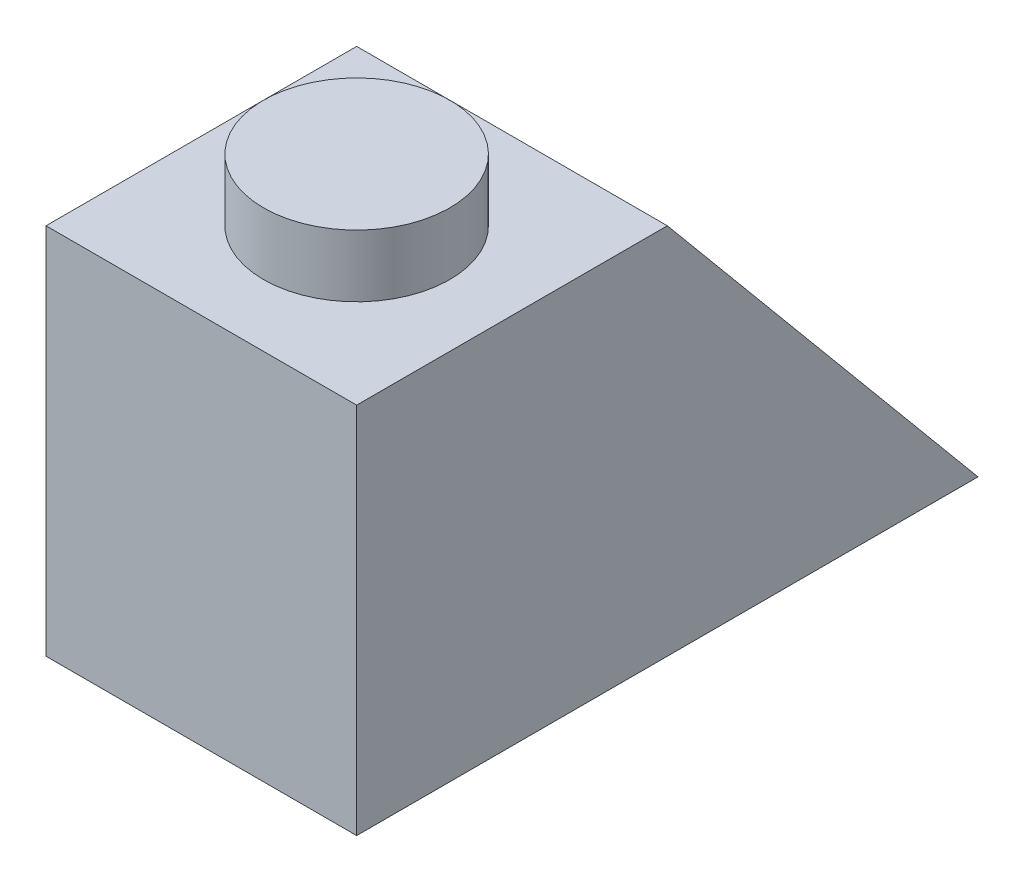
from build123d import *

# Parameters (mm, degrees)
BOSS_EXTRUDE1_DEPTH = 8
SKETCH2_R           = 2.4
BOSS_EXTRUDE2_DEPTH = 1.6
SHELL1_T            = -1.6


with BuildPart() as part:
    # Sketch1 → Boss-Extrude1 (new body)
    with BuildSketch(Plane(origin=(0, 0, 0), x_dir=(0, 0, -1), z_dir=(1, 0, 0))):
        Polygon((0, 0), (16, 0), (8, 9.6), (0, 9.6), align=None)
    extrude(amount=BOSS_EXTRUDE1_DEPTH)

    # Sketch2 → Boss-Extrude2 (add)
    with BuildSketch(Plane(origin=(0, 9.6, 0), x_dir=(1, 0, 0), z_dir=(0, 1, 0))):
        with Locations(Location((4, 4, 0), (0, 0, 270))):
            Circle(SKETCH2_R)
    extrude(amount=BOSS_EXTRUDE2_DEPTH)

    # Shell1
    shell1_openings = [part.faces().sort_by_distance(p)[0] for p in [
        (4, 0, -8),
    ]]
    offset(amount=SHELL1_T, openings=shell1_openings, kind=Kind.INTERSECTION)


solid = part.part
